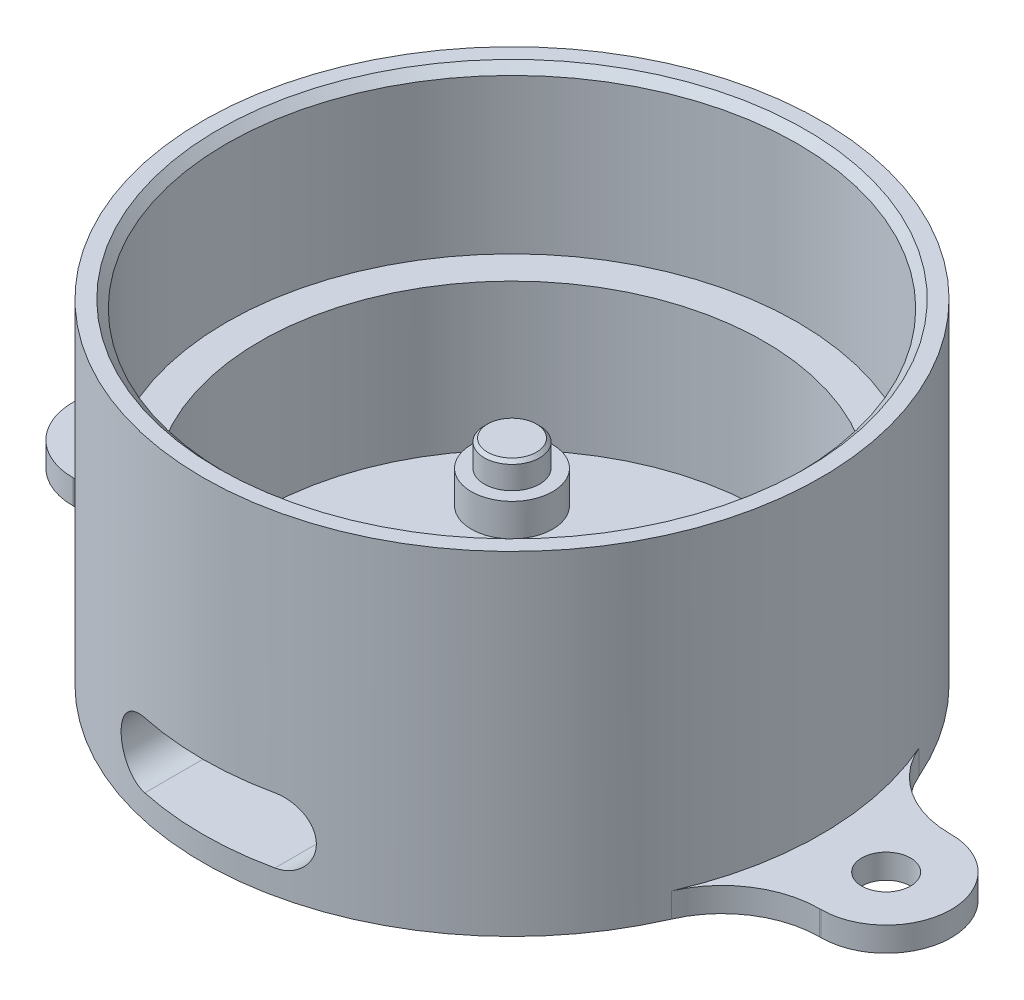
from build123d import *

# Parameters (mm, degrees)
SKETCH_2_R               = 1.5
EXTRUDE_2_DEPTH          = 1.5
SKETCH_3_R               = 19
SKETCH_3_R_2             = 15.5
EXTRUDE_3_DEPTH          = 9
SKETCH_4_R               = 2.5
EXTRUDE_4_DEPTH          = 2
SKETCH_8_R               = 19
SKETCH_8_R_2             = 17.55
EXTRUDE_5_DEPTH          = 10
SKETCH_9_R               = 1.7
SKETCH_9_R_2             = 1.6
EXTRUDE_6_DEPTH          = 1.6
CUT_EXTRUDE_2_REACH      = 53.674
CUT_EXTRUDE_2_END_RADIUS = 15.5
CHAMFER_1_SIZE           = 0.5
CHAMFER_2_SIZE           = 0.2


with BuildPart() as part:
    # Эскиз2 → Бобышка-Вытянуть2 (new body)
    with BuildSketch(Plane(origin=(0, 0, 0), x_dir=(1, 0, 0), z_dir=(0, 1, 0))):
        with BuildLine():
            Line((-23, 4), (-22.912878475, 4))
            ThreePointArc((-22.912878475, 4), (-19.62654313, 4.980039841), (-17.413787641, 7.6))
            ThreePointArc((-17.413787641, 7.6), (0, 19), (17.413787641, 7.6))
            ThreePointArc((17.413787641, 7.6), (19.62654313, 4.980039841), (22.912878475, 4))
            Line((22.912878475, 4), (23, 4))
            ThreePointArc((23, 4), (27, 0), (23, -4))
            Line((23, -4), (22.912878475, -4))
            ThreePointArc((22.912878475, -4), (19.62654313, -4.980039841), (17.413787641, -7.6))
            ThreePointArc((17.413787641, -7.6), (0, -19), (-17.413787641, -7.6))
            ThreePointArc((-17.413787641, -7.6), (-19.62654313, -4.980039841), (-22.912878475, -4))
            Line((-22.912878475, -4), (-23, -4))
            ThreePointArc((-23, -4), (-27, 0), (-23, 4))
        make_face()
        with Locations(Location((-23, 0, 0), (0, 0, 270))):
            Circle(SKETCH_2_R, mode=Mode.SUBTRACT)
        with Locations(Location((23, 0, 0), (0, 0, 90))):
            Circle(SKETCH_2_R, mode=Mode.SUBTRACT)
    extrude(amount=EXTRUDE_2_DEPTH)

    # Эскиз3 → Бобышка-Вытянуть3 (add)
    with BuildSketch(Plane(origin=(0, 1.5, 0), x_dir=(1, 0, 0), z_dir=(0, 1, 0))):
        with Locations(Location((0, 0, 0), (0, 0, 23.578178478))):
            Circle(SKETCH_3_R)
        with Locations(Location((0, 0, 0), (0, 0, 270))):
            Circle(SKETCH_3_R_2, mode=Mode.SUBTRACT)
    extrude(amount=EXTRUDE_3_DEPTH)

    # Эскиз4 → Бобышка-Вытянуть4 (add)
    with BuildSketch(Plane(origin=(0, 1.5, 0), x_dir=(1, 0, 0), z_dir=(0, 1, 0))):
        with Locations(Location((-8, -8, 0), (0, 0, 90))):
            Circle(SKETCH_4_R)
        with Locations(Location((8, -8, 0), (0, 0, 90))):
            Circle(SKETCH_4_R)
        with Locations(Location((8, 8, 0), (0, 0, 90))):
            Circle(SKETCH_4_R)
        with Locations(Location((-8, 8, 0), (0, 0, 90))):
            Circle(SKETCH_4_R)
    extrude(amount=EXTRUDE_4_DEPTH)

    # Эскиз8 → Бобышка-Вытянуть5 (add)
    with BuildSketch(Plane(origin=(0, 10.5, 0), x_dir=(1, 0, 0), z_dir=(0, 1, 0))):
        with Locations(Location((0, 0, 0), (0, 0, 23.578178478))):
            Circle(SKETCH_8_R)
        with Locations(Location((0, 0, 0), (0, 0, 270))):
            Circle(SKETCH_8_R_2, mode=Mode.SUBTRACT)
    extrude(amount=EXTRUDE_5_DEPTH)

    # Эскиз9 → Бобышка-Вытянуть6 (add)
    with BuildSketch(Plane(origin=(0, 3.5, 0), x_dir=(1, 0, 0), z_dir=(0, 1, 0))):
        with Locations(Location((-8, 8, 0), (0, 0, 270))):
            Circle(SKETCH_9_R)
        with Locations(Location((8, 8, 0), (0, 0, 270))):
            Circle(SKETCH_9_R_2)
        with Locations(Location((-8, -8, 0), (0, 0, 270))):
            Circle(SKETCH_9_R_2)
        with Locations(Location((8, -8, 0), (0, 0, 270))):
            Circle(SKETCH_9_R_2)
    extrude(amount=EXTRUDE_6_DEPTH)

    # Вырез-Вытянуть2: up to this cylinder (the profile starts outside it)
    cut_extrude_2_end = Plane(origin=(0, 3.5, 0), z_dir=(0, -1, 0)) * Cylinder(CUT_EXTRUDE_2_END_RADIUS, 139.348, mode=Mode.PRIVATE)
    # Эскиз11 → Вырез-Вытянуть2 (cut, up to the surface)
    with BuildSketch(Plane.XY.offset(20), mode=Mode.PRIVATE) as cut_extrude_2_sk1:
        with BuildLine():
            Line((-4, 5.5), (4, 5.5))
            ThreePointArc((4, 5.5), (6, 3.5), (4, 1.5))
            Line((4, 1.5), (-4, 1.5))
            ThreePointArc((-4, 1.5), (-6, 3.5), (-4, 5.5))
        make_face()
    cut_extrude_2_tool1 = extrude(cut_extrude_2_sk1.sketch, amount=-CUT_EXTRUDE_2_REACH, mode=Mode.PRIVATE) - cut_extrude_2_end
    add(cut_extrude_2_tool1.solids().sort_by_distance((0, 3.5, 20))[0], mode=Mode.SUBTRACT)

    # Фаска1
    chamfer_1_edges = [part.edges().sort_by_distance(p)[0] for p in [
        (0, 20.5, -17.55),
    ]]
    chamfer(chamfer_1_edges, length=CHAMFER_1_SIZE)

    # Фаска2
    chamfer_2_edges = [part.edges().sort_by_distance(p)[0] for p in [
        (-8, 5.1, -9.7),
        (8, 5.1, -9.6),
        (-8, 5.1, 6.4),
        (8, 5.1, 6.4),
    ]]
    chamfer(chamfer_2_edges, length=CHAMFER_2_SIZE)


solid = part.part
